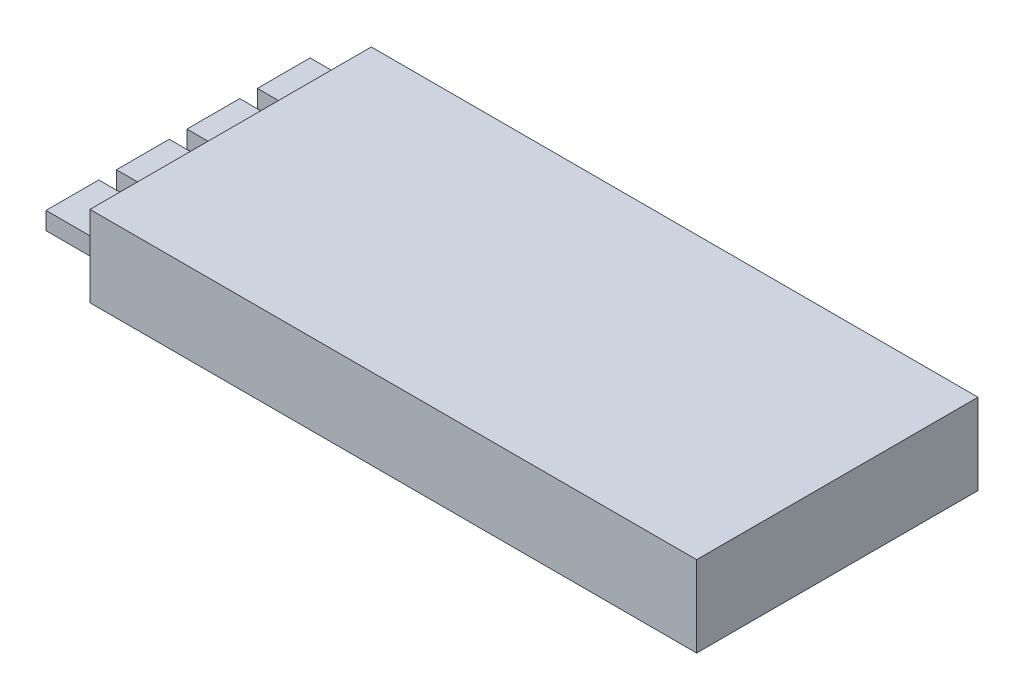
from build123d import *

# Parameters (mm, degrees)
SKETCH1_W           = 172.5
SKETCH1_H           = 80
BOSS_EXTRUDE1_DEPTH = 23
SKETCH2_W           = 15
SKETCH2_H           = 5
BOSS_EXTRUDE2_DEPTH = 15


with BuildPart() as part:
    # Sketch1 → Boss-Extrude1 (new body)
    with BuildSketch(Plane(origin=(0, 0, 0), x_dir=(1, 0, 0), z_dir=(0, 1, 0))):
        Rectangle(SKETCH1_W, SKETCH1_H)
    extrude(amount=BOSS_EXTRUDE1_DEPTH)

    # Sketch2 → Boss-Extrude2 (add)
    with BuildSketch(Plane.ZY.offset(86.25)):
        with Locations((9.965110339, 11.5)):
            Rectangle(SKETCH2_W, SKETCH2_H)
        with Locations((30, 11.5)):
            Rectangle(SKETCH2_W, SKETCH2_H)
        with Locations((-10.069779322, 11.5)):
            Rectangle(SKETCH2_W, SKETCH2_H)
        with Locations((-30.104668983, 11.5)):
            Rectangle(SKETCH2_W, SKETCH2_H)
    extrude(amount=BOSS_EXTRUDE2_DEPTH)


solid = part.part
